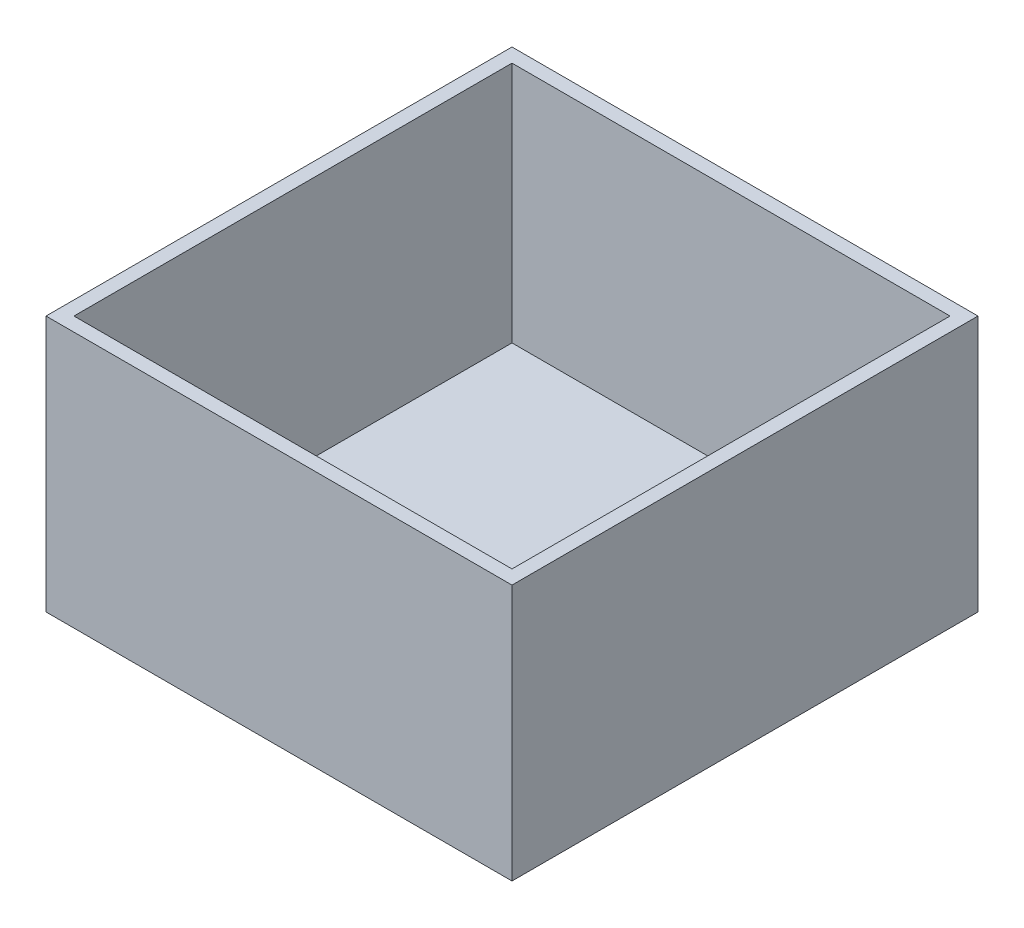
from build123d import *

# Parameters (mm, degrees)
SKETCH_1_W           = 20
SKETCH_1_H           = 20
EXTRUDE_1_DEPTH      = 120
SKETCH_2_W           = 10
SKETCH_2_H           = 20
CUT_EXTRUDE_1_DEPTH  = 120
CUT_EXTRUDE_2_DEPTH  = 120
SKETCH_4_R           = 3
CUT_EXTRUDE_3_DEPTH  = 2
SKETCH_8_W           = 19.6
SKETCH_8_H           = 0.2
SKETCH_8_W_2         = 0.2
SKETCH_8_H_2         = 19.6
CUT_EXTRUDE_6_DEPTH  = 15
SKETCH_9_W           = 10
SKETCH_9_H           = 20
CUT_EXTRUDE_7_DEPTH  = 20
SKETCH_10_W          = 19.6
SKETCH_10_H          = 19.6
EXTRUDE_2_DEPTH      = 15
CUT_EXTRUDE_8_DEPTH  = 20
CUT_EXTRUDE_9_DEPTH  = 20
SKETCH_13_W          = 55
SKETCH_13_H          = 20
SKETCH_13_W_2        = 18.82824967
CUT_EXTRUDE_10_DEPTH = 20
SKETCH_14_W          = 100
SKETCH_14_H          = 55
EXTRUDE_5_DEPTH      = 5
SKETCH_17_W          = 2
SKETCH_17_H          = 55
CUT_EXTRUDE_12_DEPTH = 1000
EXTRUDE_6_DEPTH      = 94
SKETCH_19_W          = 3
SKETCH_19_H          = 55
EXTRUDE_7_DEPTH      = 100


with BuildPart() as part:
    # 草图1 → 凸台-拉伸1 (new body)
    with BuildSketch(Plane.XY):
        with Locations((10, 10)):
            Rectangle(SKETCH_1_W, SKETCH_1_H)
    extrude(amount=EXTRUDE_1_DEPTH)

    # 草图2 → 切除-拉伸1 (cut)
    with BuildSketch(Plane(origin=(0, 20, 0), x_dir=(1, 0, 0), z_dir=(0, 1, 0))):
        with Locations((15, -10)):
            Rectangle(SKETCH_2_W, SKETCH_2_H)
    extrude(amount=-CUT_EXTRUDE_1_DEPTH, mode=Mode.SUBTRACT)

    # 草图3 → 切除-拉伸2 (cut)
    with BuildSketch(Plane(origin=(10, 0, 0), x_dir=(0, 0, -1), z_dir=(1, 0, 0))):
        with BuildLine():
            ThreePointArc((-8.45, 10), (-9.40684068, 11.432013275), (-11.096015511, 11.096015511))
            Line((-11.096015511, 11.096015511), (-8.903984489, 8.903984489))
            ThreePointArc((-8.903984489, 8.903984489), (-8.567986725, 9.40684068), (-8.45, 10))
        make_face()
        with BuildLine():
            Line((-8.903984489, 8.903984489), (-11.096015511, 11.096015511))
            ThreePointArc((-11.096015511, 11.096015511), (-11.096015511, 8.903984489), (-8.903984489, 8.903984489))
        make_face()
    extrude(amount=-CUT_EXTRUDE_2_DEPTH, mode=Mode.SUBTRACT)

    # 草图4 → 切除-拉伸3 (cut)
    with BuildSketch(Plane.ZY):
        with Locations((10, 10)):
            Circle(SKETCH_4_R)
    extrude(amount=-CUT_EXTRUDE_3_DEPTH, mode=Mode.SUBTRACT)

    # 草图8 → 切除-拉伸6 (cut)
    with BuildSketch(Plane.XY.offset(120)):
        with Locations((10, 19.9)):
            Rectangle(SKETCH_8_W, SKETCH_8_H)
        with Locations((0.1, 19.9)):
            Rectangle(SKETCH_8_W_2, SKETCH_8_H)
        with Locations((0.1, 10)):
            Rectangle(SKETCH_8_W_2, SKETCH_8_H_2)
        with Locations((19.9, 10)):
            Rectangle(SKETCH_8_W_2, SKETCH_8_H_2)
        with Locations((19.9, 0.1)):
            Rectangle(SKETCH_8_W_2, SKETCH_8_H)
        with Locations((10, 0.1)):
            Rectangle(SKETCH_8_W, SKETCH_8_H)
        with Locations((0.1, 0.1)):
            Rectangle(SKETCH_8_W_2, SKETCH_8_H)
        with Locations((19.9, 19.9)):
            Rectangle(SKETCH_8_W_2, SKETCH_8_H)
    extrude(amount=-CUT_EXTRUDE_6_DEPTH, mode=Mode.SUBTRACT)

    # 草图9 → 切除-拉伸7 (cut)
    with BuildSketch(Plane(origin=(0, 20, 0), x_dir=(1, 0, 0), z_dir=(0, 1, 0))):
        Polygon((0, 0), (0, -45), (20, -45), (20, -20), (10, -20), (10, 0), align=None)
        with Locations((15, -10)):
            Rectangle(SKETCH_9_W, SKETCH_9_H)
    extrude(amount=-CUT_EXTRUDE_7_DEPTH, mode=Mode.SUBTRACT)

    # 草图10 → 凸台-拉伸2 (add)
    with BuildSketch(Plane(origin=(0, 0, 45), x_dir=(-1, 0, 0), z_dir=(0, 0, -1))):
        with Locations((-10, 10)):
            Rectangle(SKETCH_10_W, SKETCH_10_H)
    extrude(amount=EXTRUDE_2_DEPTH)

    # 草图11 → 切除-拉伸8 (cut)
    with BuildSketch(Plane(origin=(0, 19.8, 0), x_dir=(1, 0, 0), z_dir=(0, 1, 0))):
        with BuildLine():
            ThreePointArc((11.547573501, -112.5), (10.487812185, -111.029569439), (8.757681845, -111.569855559))
            Line((8.757681845, -111.569855559), (11.237465157, -113.430144441))
            ThreePointArc((11.237465157, -113.430144441), (11.468004062, -112.990238683), (11.547573501, -112.5))
        make_face()
        with BuildLine():
            Line((11.237465157, -113.430144441), (8.757681845, -111.569855559))
            ThreePointArc((8.757681845, -111.569855559), (9.06742906, -113.739891656), (11.237465157, -113.430144441))
        make_face()
    extrude(amount=-CUT_EXTRUDE_8_DEPTH, mode=Mode.SUBTRACT)

    # 草图12 → 切除-拉伸9 (cut)
    with BuildSketch(Plane(origin=(0, 19.8, 0), x_dir=(1, 0, 0), z_dir=(0, 1, 0))):
        with BuildLine():
            ThreePointArc((11.55, -37.5), (10.490153037, -36.029540888), (8.76, -36.57))
            Line((8.76, -36.57), (11.24, -38.43))
            ThreePointArc((11.24, -38.43), (11.470459112, -37.990153037), (11.55, -37.5))
        make_face()
        with BuildLine():
            Line((11.24, -38.43), (8.76, -36.57))
            ThreePointArc((8.76, -36.57), (9.07, -38.74), (11.24, -38.43))
        make_face()
    extrude(amount=-CUT_EXTRUDE_9_DEPTH, mode=Mode.SUBTRACT)

    # 草图13 → 切除-拉伸10 (cut)
    with BuildSketch(Plane.ZY):
        with Locations((77.5, 10)):
            Rectangle(SKETCH_13_W, SKETCH_13_H)
        with Locations((114.414124835, 10)):
            Rectangle(SKETCH_13_W_2, SKETCH_13_H)
    extrude(amount=-CUT_EXTRUDE_10_DEPTH, mode=Mode.SUBTRACT)

    # 草图14 → 凸台-拉伸5 (add)
    with BuildSketch(Plane.XY.offset(50)):
        with Locations((10, 17.5)):
            Rectangle(SKETCH_14_W, SKETCH_14_H)
    extrude(amount=-EXTRUDE_5_DEPTH)

    # 草图17 → 切除-拉伸12 (cut)
    with BuildSketch(Plane.ZY.offset(40)):
        with Locations((49, 17.5)):
            Rectangle(SKETCH_17_W, SKETCH_17_H)
    extrude(amount=-CUT_EXTRUDE_12_DEPTH, mode=Mode.SUBTRACT)

    # 草图18 → 凸台-拉伸6 (add)
    with BuildSketch(Plane.XY.offset(48)):
        Polygon((-40, -10), (60, -10), (60, 45), (57, 45), (57, -7), (-37, -7), (-37, 45), (-40, 45), align=None)
    extrude(amount=EXTRUDE_6_DEPTH)

    # 草图19 → 凸台-拉伸7 (add)
    with BuildSketch(Plane(origin=(60, 0, 0), x_dir=(0, 0, -1), z_dir=(1, 0, 0))):
        with Locations((-143.5, 17.5)):
            Rectangle(SKETCH_19_W, SKETCH_19_H)
    extrude(amount=-EXTRUDE_7_DEPTH)


solid = part.part
